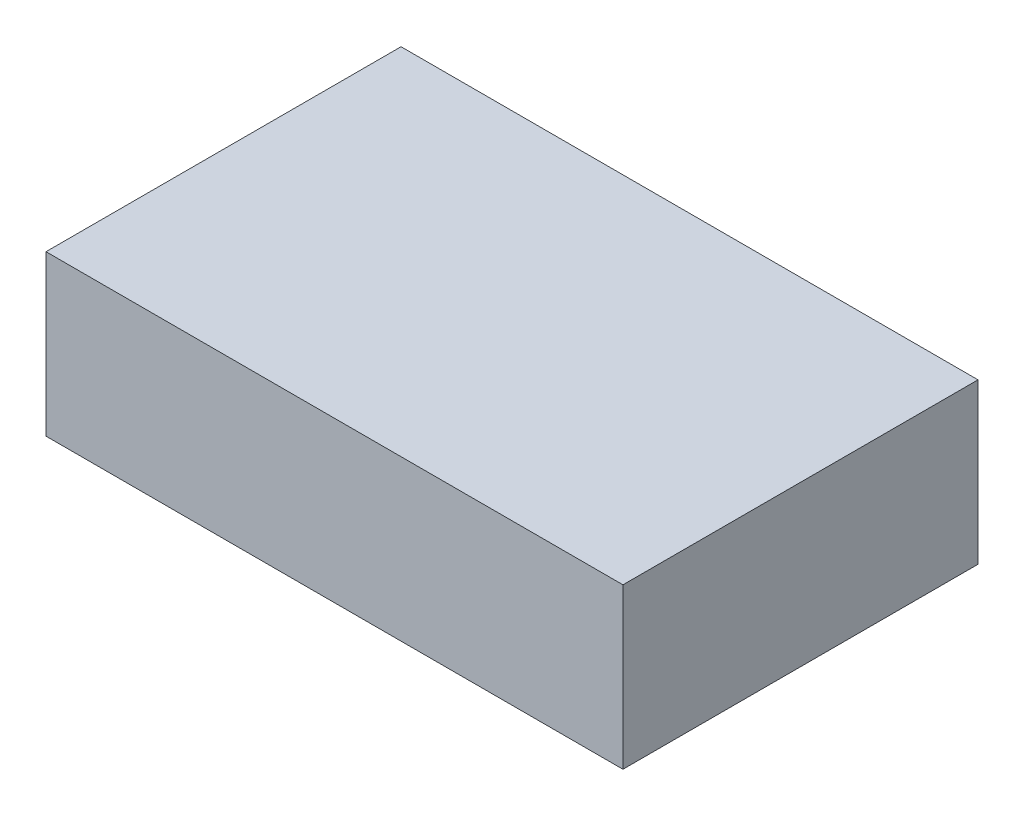
from build123d import *

# Parameters (mm, degrees)
SKETCH1_W           = 82.55
SKETCH1_H           = 50.8
BOSS_EXTRUDE1_DEPTH = 22.86


with BuildPart() as part:
    # Sketch1 → Boss-Extrude1 (new body)
    with BuildSketch(Plane(origin=(0, 0, 0), x_dir=(1, 0, 0), z_dir=(0, 1, 0))):
        with Locations((41.275, 25.4)):
            Rectangle(SKETCH1_W, SKETCH1_H)
    extrude(amount=BOSS_EXTRUDE1_DEPTH)


solid = part.part
